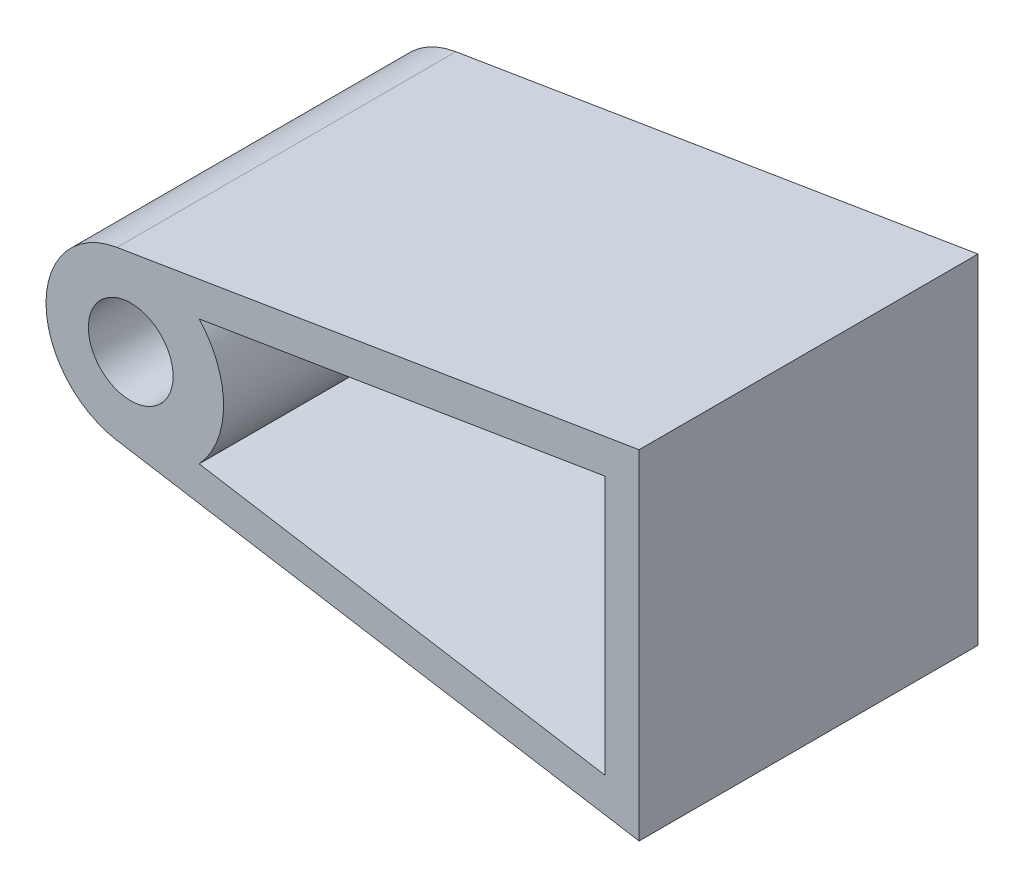
from build123d import *

# Parameters (mm, degrees)
SKETCH_1_R          = 2.5
EXTRUDE_1_DEPTH     = 10
CUT_EXTRUDE_1_DEPTH = 42.533119315


with BuildPart() as part:
    # 草图1 → 凸台-拉伸1 (new, symmetric)
    with BuildSketch(Plane.XY):
        with BuildLine():
            Line((0, 10), (0, -10))
            Line((0, -10), (-30.8112495, -4.933748499))
            ThreePointArc((-30.8112495, -4.933748499), (-35, 0), (-30.8112495, 4.933748499))
            Line((-30.8112495, 4.933748499), (0, 10))
        make_face()
        with Locations((-30, 0)):
            Circle(SKETCH_1_R, mode=Mode.SUBTRACT)
    extrude(amount=EXTRUDE_1_DEPTH, both=True)

    # 草图2 → 切除-拉伸1 (cut, through all)
    with BuildSketch(Plane.XY.offset(10)):
        with BuildLine():
            Line((-25.960774055, -3.704449068), (-2, -7.644286286))
            Line((-2, -7.644286286), (-2, 7.644286286))
            Line((-2, 7.644286286), (-25.960774055, 3.704449068))
            ThreePointArc((-25.960774055, 3.704449068), (-24.519280236, 0), (-25.960774055, -3.704449068))
        make_face()
    extrude(amount=-CUT_EXTRUDE_1_DEPTH, mode=Mode.SUBTRACT)


solid = part.part
